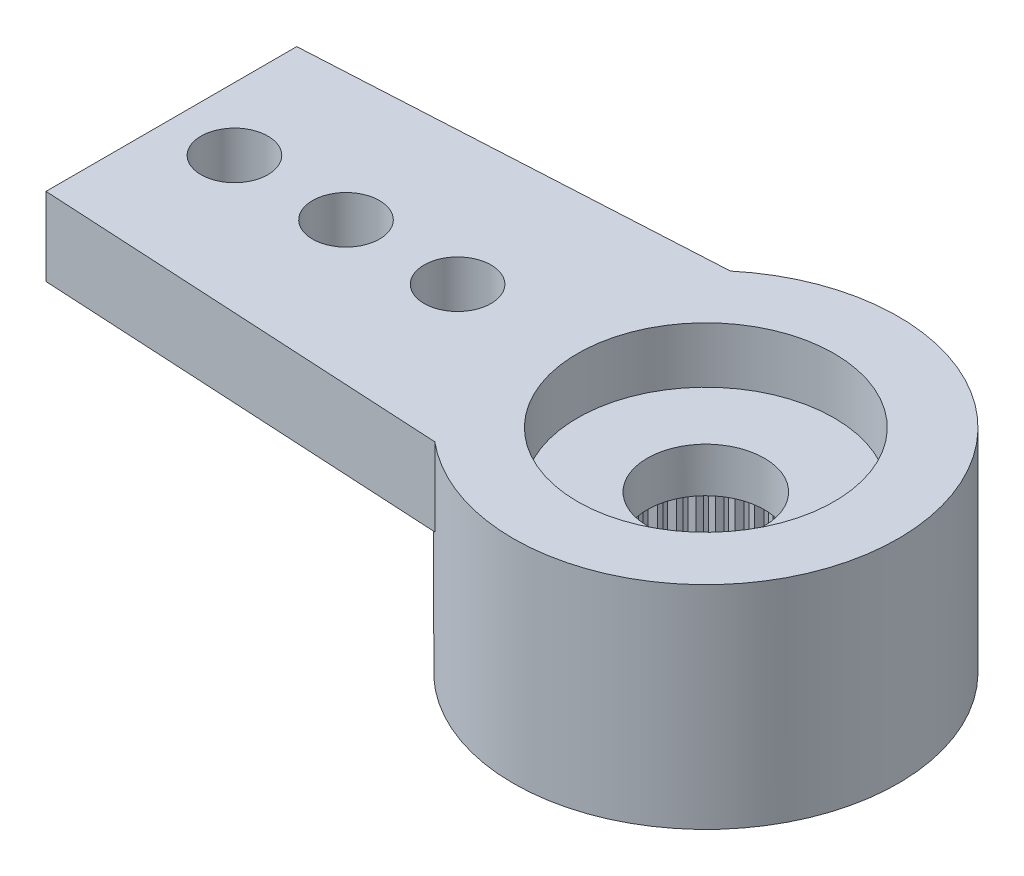
from build123d import *

# Parameters (mm, degrees)
RESSALTO_EXTRUS_O1_DEPTH = 1.4
ESBO_O2_R                = 3.45
RESSALTO_EXTRUS_O2_DEPTH = 2.4
FURO4_D                  = 1.2
PADR_O_LINEAR1_COUNT     = 6
PADR_O_LINEAR1_PITCH     = 2
FURO1_D                  = 4.95
FURO1_DEPTH              = 2
FURO2_D                  = 4.6
FURO2_DEPTH              = 1
FURO3_D                  = 2.1
RESSALTO_EXTRUS_O3_START = -2
RESSALTO_EXTRUS_O3_DEPTH = 2
PADR_OCIRCULAR1_COUNT    = 60
SKETCH1_W                = 8.170859267
SKETCH1_H                = 9.635836561
CUT_EXTRUDE1_DEPTH       = 10


with BuildPart() as part:
    # Esboço1 → Ressalto-extrusão1 (new body)
    with BuildSketch(Plane(origin=(0, 0, 0), x_dir=(1, 0, 0), z_dir=(0, 1, 0))):
        with BuildLine():
            Line((-14.159121967, 1.99702088), (-2.209072203, 2.65))
            ThreePointArc((-2.209072203, 2.65), (3.45, 0), (-2.209072203, -2.65))
            Line((-2.209072203, -2.65), (-14.159121967, -1.99702088))
            ThreePointArc((-14.159121967, -1.99702088), (-16.05, 0), (-14.159121967, 1.99702088))
        make_face()
    extrude(amount=-RESSALTO_EXTRUS_O1_DEPTH)

    # Esboço2 → Ressalto-extrusão2 (add)
    with BuildSketch(Plane.XZ.offset(1.4)):
        with Locations(Location((0, 0, 0), (0, 0, 90))):
            Circle(ESBO_O2_R)
    extrude(amount=RESSALTO_EXTRUS_O2_DEPTH)

    # Furo4 (through all)
    with Locations(Plane(origin=(0, 0, 0), x_dir=(1, 0, 0), z_dir=(0, 1, 0))):
        with Locations((-14.45, 0)):
            furo4 = Hole(FURO4_D / 2)

    # Padrão linear1: Furo4 ×6
    with Locations(*[(i * PADR_O_LINEAR1_PITCH, 0, 0) for i in range(1, PADR_O_LINEAR1_COUNT)]):
        add(furo4, mode=Mode.SUBTRACT)

    # Furo1
    with Locations(Plane(origin=(0, -3.8, 0), x_dir=(-1, 0, 0), z_dir=(0, -1, 0))):
        with Locations((0, 0)):
            Hole(FURO1_D / 2, depth=FURO1_DEPTH)

    # Furo2
    with Locations(Plane(origin=(0, 0, 0), x_dir=(1, 0, 0), z_dir=(0, 1, 0))):
        with Locations((0, 0)):
            Hole(FURO2_D / 2, depth=FURO2_DEPTH)

    # Furo3 (through all)
    with Locations(Plane(origin=(0, 0, 0), x_dir=(1, 0, 0), z_dir=(0, 1, 0))):
        with Locations((0, 0)):
            Hole(FURO3_D / 2)

    # Esboço11 → Ressalto-extrusão3 (add)
    with BuildSketch(Plane.XZ.offset(3.8).offset(RESSALTO_EXTRUS_O3_START)):
        with BuildLine():
            Line((-0.098056786, 2.473056786), (0, 2.375))
            Line((0, 2.375), (0.098056786, 2.473056786))
            ThreePointArc((0.098056786, 2.473056786), (0, 2.475), (-0.098056786, 2.473056786))
        make_face()
    ressalto_extrus_o3 = extrude(amount=RESSALTO_EXTRUS_O3_DEPTH)

    # PadrãoCircular1: Ressalto-extrusão3 ×60 about axis
    padr_ocircular1_axis = Axis((0, 0, 0), (0, 1, 0))
    for i in range(1, PADR_OCIRCULAR1_COUNT):
        add(ressalto_extrus_o3.rotate(padr_ocircular1_axis, i * 360 / PADR_OCIRCULAR1_COUNT))

    # Sketch1 → Cut-Extrude1 (cut)
    with BuildSketch(Plane(origin=(0, 0, 0), x_dir=(1, 0, 0), z_dir=(0, 1, 0))):
        with Locations((-13.666153431, 0.299185503)):
            Rectangle(SKETCH1_W, SKETCH1_H)
    extrude(amount=-CUT_EXTRUDE1_DEPTH, mode=Mode.SUBTRACT)


solid = part.part
